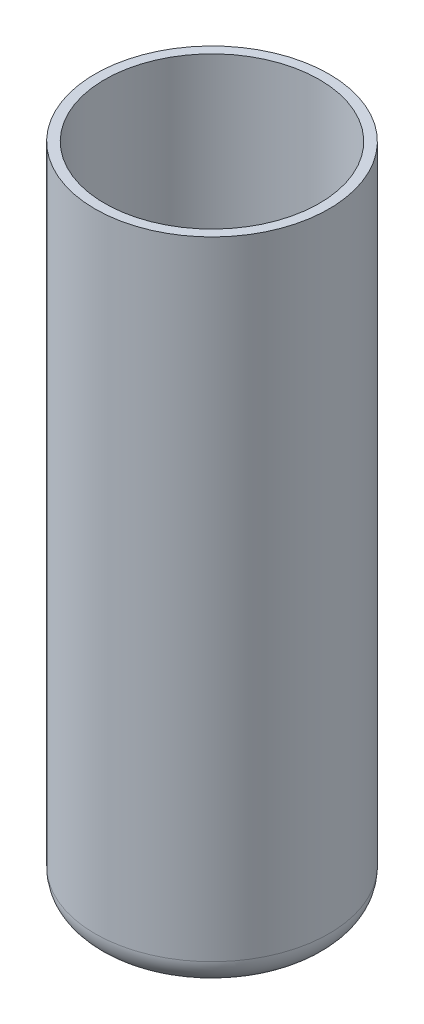
from build123d import *


with BuildPart() as part:
    # Sketch2 → Revolve1 (revolve)
    with BuildSketch(Plane.XY, mode=Mode.PRIVATE) as revolve1_sk:
        with BuildLine():
            Line((27.530975966, 168), (27.530975966, 7))
            ThreePointArc((27.530975966, 7), (24.005991012, 4.779859802), (20, 3.636803621))
            Line((20, 3.636803621), (0, 3.636803621))
            Line((0, 3.636803621), (0, 0))
            Line((0, 0), (23, 0))
            ThreePointArc((23, 0), (27.949747468, 2.050252532), (30, 7))
            Line((30, 7), (30, 168))
            Line((30, 168), (27.530975966, 168))
        make_face()
    revolve(revolve1_sk.sketch.rotate(Axis((0, 0, 0), (0, 1, 0)), 90), axis=Axis((0, 0, 0), (0, 1, 0)))


solid = part.part
